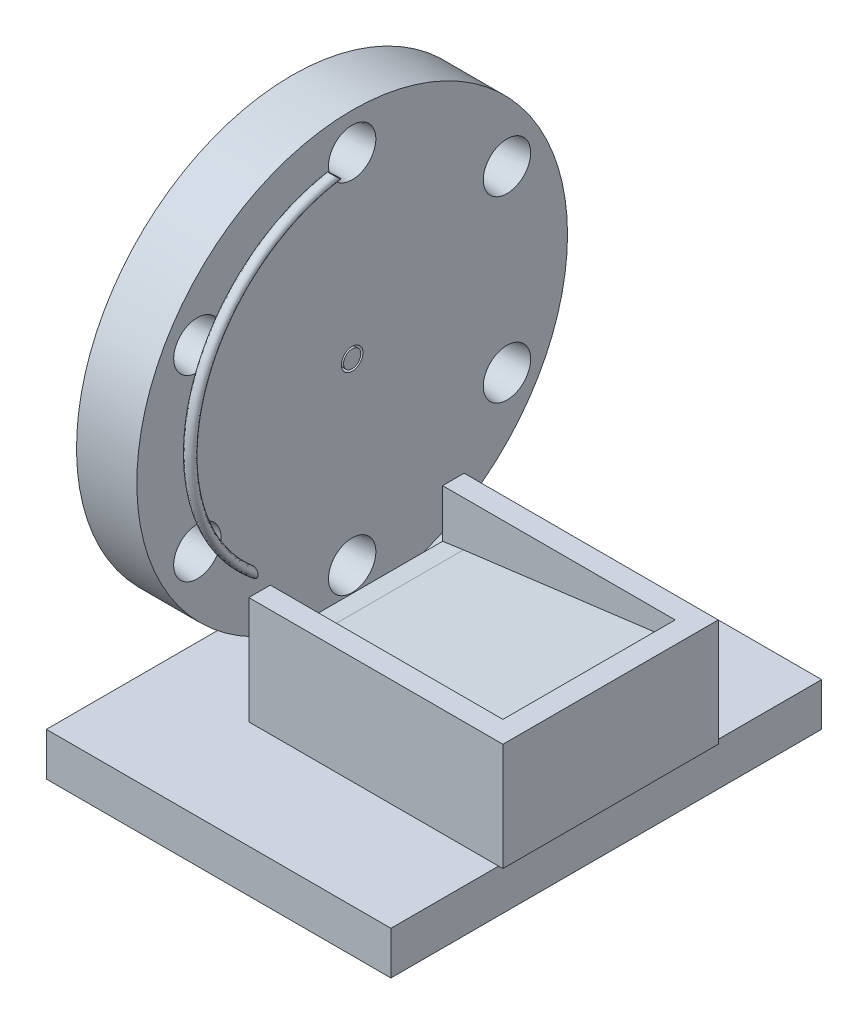
from build123d import *

# Parameters (mm, degrees)
SKETCH_2_W               = 80
SKETCH_2_H               = 100
EXTRUDE_2_DEPTH          = 10
SKETCH_3_W               = 6
SKETCH_3_H               = 8
EXTRUDE_3_DEPTH          = 60
SKETCH_4_R               = 4
EXTRUDE_4_DEPTH          = 6
SKETCH_5_R               = 2.5
CUT_EXTRUDE_1_DEPTH      = 50
SKETCH_6_R               = 50
EXTRUDE_5_DEPTH          = 15
PATTERN_CIRCULAR_2_COUNT = 6
CUT_EXTRUDE_START        = -20
SKETCH_10_R              = 2.5
CUT_EXTRUDE_2_DEPTH      = 20
SKETCH_11_W              = 60
SKETCH_11_H              = 50
EXTRUDE_6_DEPTH          = 25
SKETCH_12_W              = 55
SKETCH_12_H              = 40
CUT_EXTRUDE_3_DEPTH      = 10.5
EXTRUDE_7_DEPTH          = 40
SKETCH_15_R              = 1.25
SKETCH_17_W              = 1
SKETCH_17_H              = 109.276190726
SKETCH_17_H_2            = 27.184264357
CUT_EXTRUDE_4_DEPTH      = 75
SKETCH_16_R              = 2
EXTRUDE_9_DEPTH          = 21
CUT_EXTRUDE_5_DEPTH      = 40


with BuildPart() as part:
    # 草圖2 → 填料-伸長2 (new body)
    with BuildSketch(Plane(origin=(0, 0, 0), x_dir=(1, 0, 0), z_dir=(0, 1, 0))):
        Rectangle(SKETCH_2_W, SKETCH_2_H)
    extrude(amount=EXTRUDE_2_DEPTH)

    # 草圖3 → 填料-伸長3 (add)
    with BuildSketch(Plane(origin=(0, 10, 0), x_dir=(1, 0, 0), z_dir=(0, 1, 0))):
        with Locations((-37, 0)):
            Rectangle(SKETCH_3_W, SKETCH_3_H)
    extrude(amount=EXTRUDE_3_DEPTH)

    # 草圖4 → 填料-伸長4 (add)
    with BuildSketch(Plane.ZY.offset(40)):
        with Locations((0, 70)):
            Circle(SKETCH_4_R)
    extrude(amount=-EXTRUDE_4_DEPTH)

    # 草圖5 → 除料-伸長1 (cut)
    with BuildSketch(Plane.ZY.offset(40)):
        with Locations((0, 70)):
            Circle(SKETCH_5_R)
    extrude(amount=-CUT_EXTRUDE_1_DEPTH, mode=Mode.SUBTRACT)

    # 草圖6 → 填料-伸長5 (add)
    with BuildSketch(Plane(origin=(-34, 0, 0), x_dir=(0, 0, -1), z_dir=(1, 0, 0))):
        with Locations(Location((0, 70, 0), (0, 0, 265.411434264))):
            Circle(SKETCH_6_R)
    extrude(amount=EXTRUDE_5_DEPTH)

    # 草圖8 → 除料-旋轉5 (revolve, cut)
    with BuildSketch(Plane.XY, mode=Mode.PRIVATE) as cut_revolve_5_sk:
        Polygon((-19, 23), (-19, 28.5), (-31.5, 28.5), (-31.5, 24.5), align=None)
    cut_revolve_5 = revolve(cut_revolve_5_sk.sketch.rotate(Axis((-31.5, 28.5, 0), (1, 0, 0)), 270), axis=Axis((-31.5, 28.5, 0), (1, 0, 0)), mode=Mode.SUBTRACT)

    # 環狀複製排列2: 除料-旋轉5 ×6 about axis
    pattern_circular_2_axis = Axis((0, 70, 0), (1, 0, 0))
    for i in range(1, PATTERN_CIRCULAR_2_COUNT):
        add(cut_revolve_5.rotate(pattern_circular_2_axis, i * 360 / PATTERN_CIRCULAR_2_COUNT), mode=Mode.SUBTRACT)

    # 草圖10 → 除料-伸長2 (cut)
    with BuildSketch(Plane(origin=(-19, 0, 0), x_dir=(0, 0, -1), z_dir=(1, 0, 0)).offset(CUT_EXTRUDE_START)):
        with Locations(Location((0, 70, 0), (0, 0, 180))):
            Circle(SKETCH_10_R)
    extrude(amount=CUT_EXTRUDE_2_DEPTH, mode=Mode.SUBTRACT)

    # 草圖11 → 填料-伸長6 (add)
    with BuildSketch(Plane(origin=(0, 10, 0), x_dir=(1, 0, 0), z_dir=(0, 1, 0))):
        with Locations((11, 0)):
            Rectangle(SKETCH_11_W, SKETCH_11_H)
    extrude(amount=EXTRUDE_6_DEPTH)

    # 草圖12 → 除料-伸長3 (cut)
    with BuildSketch(Plane(origin=(0, 35, 0), x_dir=(1, 0, 0), z_dir=(0, 1, 0))):
        with Locations((8.5, 0)):
            Rectangle(SKETCH_12_W, SKETCH_12_H)
    extrude(amount=-CUT_EXTRUDE_3_DEPTH, mode=Mode.SUBTRACT)

    # 草圖13 → 填料-伸長7 (add)
    with BuildSketch(Plane.XY.offset(-20)):
        Polygon((36, 30.803264742), (-13.166276329, 24.5), (36, 24.5), align=None)
    extrude(amount=EXTRUDE_7_DEPTH)

    # 草圖17 → 除料-伸長4 (cut, symmetric)
    with BuildSketch(Plane.XY):
        with Locations((-33.5, 69.047787496)):
            Rectangle(SKETCH_17_W, SKETCH_17_H)
        with Locations((-18.5, 23.592132179)):
            Rectangle(SKETCH_17_W, SKETCH_17_H_2)
    extrude(amount=CUT_EXTRUDE_4_DEPTH, both=True, mode=Mode.SUBTRACT)


with BuildPart() as body_2:
    # 掃出1: sweep along a path in 草圖14
    with BuildLine(Plane(origin=(-16.5, 0, 0), x_dir=(0, 0, -1), z_dir=(1, 0, 0))) as sweep_1_path:
        ThreePointArc((-25.574640108, 41.213690819), (-38.70103061, 82.426016401), (-6.642763665, 111.460916572))
    # 草圖15 → 掃出1 (sweep)
    with BuildSketch(Plane.XY.offset(25.574640108)):
        with Locations((-16.5, 41.213690819)):
            Circle(SKETCH_15_R)
    sweep(path=sweep_1_path.line)


with BuildPart() as cut_extrude_4_piece_1:
    # of the separate pieces the step leaves, piece 1, a body of its own (cut_extrude_4_pieces)
    add(part.part.solids().sort_by_distance((40, 0, 50))[0])

    # 草圖21 → 除料-伸長5 (cut)
    with BuildSketch(Plane.XY.offset(-20)):
        Polygon((-13.166276329, 24.5), (-18, 23.813296447), (-18, 24.5), align=None)
    extrude(amount=CUT_EXTRUDE_5_DEPTH, mode=Mode.SUBTRACT)


with BuildPart() as cut_extrude_4_piece_2:
    # of the separate pieces the step leaves, piece 2, a body of its own (cut_extrude_4_pieces)
    add(part.part.solids().sort_by_distance((-19, 28.5, 5.5))[0])


with BuildPart() as body_4:
    # 草圖16 → 填料-伸長9 (new, through all)
    with BuildSketch(Plane(origin=(-19, 0, 0), x_dir=(0, 0, -1), z_dir=(1, 0, 0))):
        with Locations((0, 70)):
            Circle(SKETCH_16_R)
    extrude(amount=-EXTRUDE_9_DEPTH)


solid = Compound([body_2.part, cut_extrude_4_piece_1.part, cut_extrude_4_piece_2.part, body_4.part])
